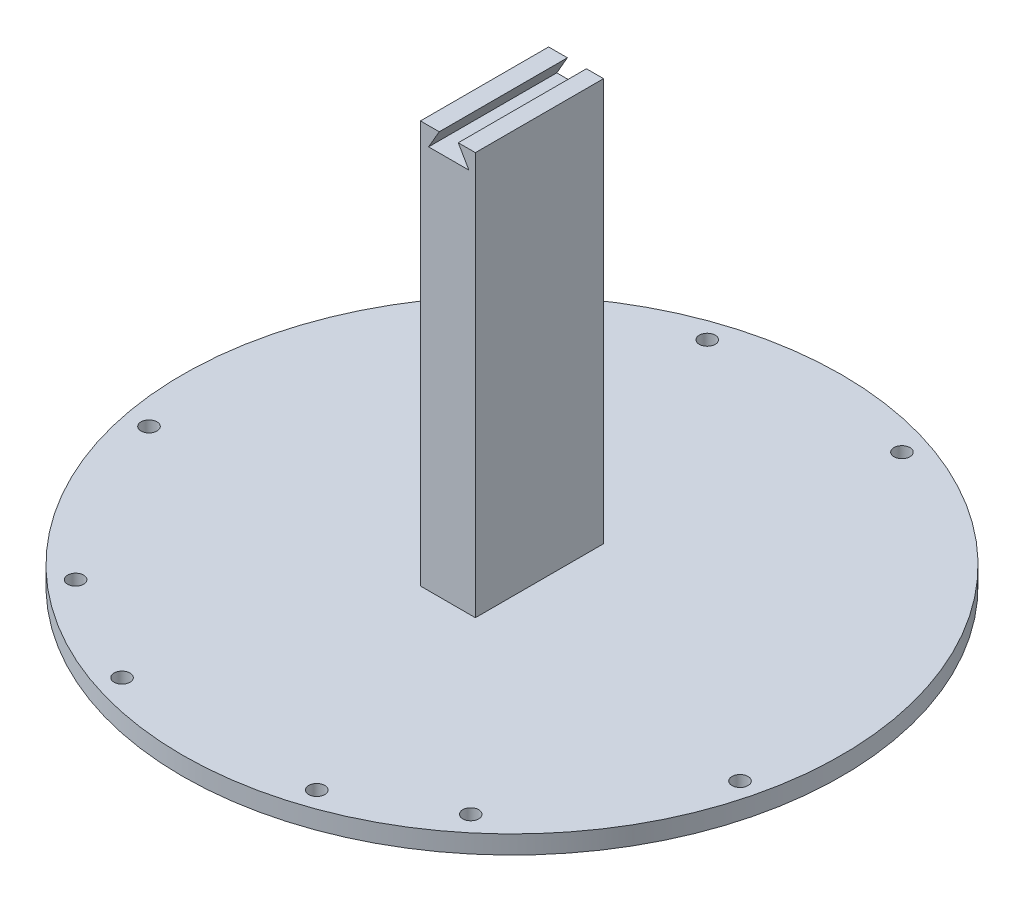
from build123d import *

# Parameters (mm, degrees)
SKETCH1_R           = 90
BOSS_EXTRUDE1_DEPTH = 5
SKETCH2_W           = 15
SKETCH2_H           = 35
BOSS_EXTRUDE2_DEPTH = 110
CUT_EXTRUDE1_DEPTH  = 36
SKETCH4_R           = 2.18255
CUT_EXTRUDE2_DEPTH  = 62


with BuildPart() as part:
    # Sketch1 → Boss-Extrude1 (new body)
    with BuildSketch(Plane(origin=(0, 0, 0), x_dir=(1, 0, 0), z_dir=(0, 1, 0))):
        with Locations(Location((0, 0, 0), (0, 0, 270))):
            Circle(SKETCH1_R)
    extrude(amount=BOSS_EXTRUDE1_DEPTH)

    # Sketch2 → Boss-Extrude2 (add)
    with BuildSketch(Plane(origin=(0, 5, 0), x_dir=(1, 0, 0), z_dir=(0, 1, 0))):
        Rectangle(SKETCH2_W, SKETCH2_H)
    extrude(amount=BOSS_EXTRUDE2_DEPTH)

    # Sketch3 → Cut-Extrude1 (cut)
    with BuildSketch(Plane.XY.offset(17.5)):
        Polygon((-2.373551685, 115), (2.826448315, 115), (5.726448315, 109.977052658), (-5.273551685, 109.977052658), align=None)
    extrude(amount=-CUT_EXTRUDE1_DEPTH, mode=Mode.SUBTRACT)

    # Sketch4 → Cut-Extrude2 (cut)
    with BuildSketch(Plane(origin=(0, 0, 0), x_dir=(-1, 0, 0), z_dir=(0, -1, 0))):
        with Locations(Location((-26.585, 79.907325251, 0), (0, 0, 90))):
            Circle(SKETCH4_R)
        with Locations(Location((26.585, 79.907325251, 0), (0, 0, 90))):
            Circle(SKETCH4_R)
        with Locations(Location((82.310329065, -16.825152102, 0), (0, 0, 90))):
            Circle(SKETCH4_R)
        with Locations(Location((56.093218167, -63.082173149, 0), (0, 0, 90))):
            Circle(SKETCH4_R)
        with Locations(Location((26.585, -79.907325251, 0), (0, 0, 90))):
            Circle(SKETCH4_R)
        with Locations(Location((-26.585, -79.907325251, 0), (0, 0, 90))):
            Circle(SKETCH4_R)
        with Locations(Location((-53.346563788, -64.612502947, 0), (0, 0, 90))):
            Circle(SKETCH4_R)
        with Locations(Location((-82.245302282, -19.978089739, 0), (0, 0, 90))):
            Circle(SKETCH4_R)
    extrude(amount=-CUT_EXTRUDE2_DEPTH, mode=Mode.SUBTRACT)


solid = part.part
